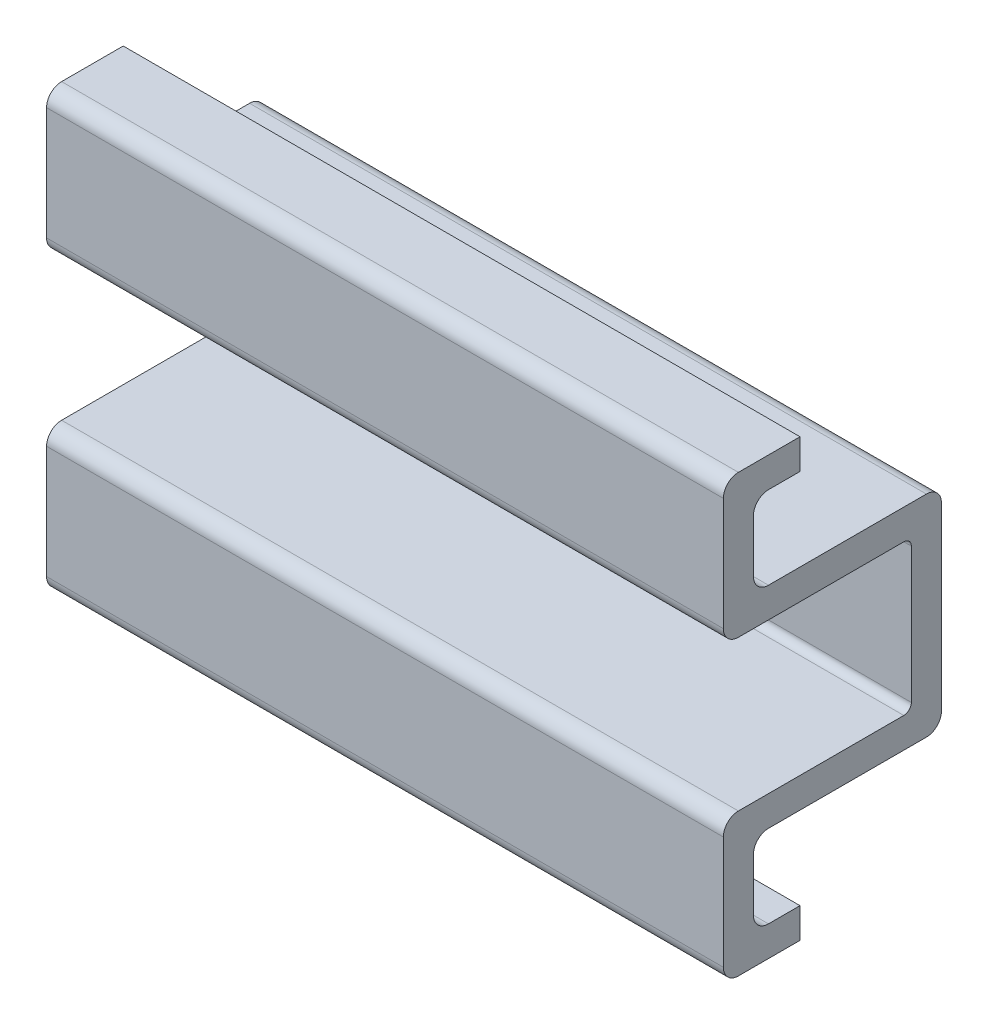
from build123d import *

# Parameters (mm, degrees)
BOSS_EXTRUDE1_DEPTH = 45
FILLET1_R           = 1
FILLET2_R           = 0.5


with BuildPart() as part:
    # Sketch3 → Boss-Extrude1 (new body)
    with BuildSketch(Plane(origin=(0, 0, 0), x_dir=(0, 0, -1), z_dir=(1, 0, 0))):
        Polygon((-3.729267548, 0), (-5.729267548, 0), (-5.729267548, -5), (-18.229267548, -5), (-18.229267548, -14.5), (-13.131696696, -14.5), (-13.131696696, -12.5), (-14.52244663, -12.5), (-16.229267548, -12.5), (-16.229267548, -7), (-3.729267548, -7), align=None)
        Polygon((-18.229267548, 5), (-5.729267548, 5), (-5.729267548, 0), (-3.729267548, 0), (-3.729267548, 7), (-16.229267548, 7), (-16.229267548, 12.5), (-14.52244663, 12.5), (-13.131696696, 12.5), (-13.131696696, 14.5), (-18.229267548, 14.5), align=None)
    extrude(amount=BOSS_EXTRUDE1_DEPTH)

    # Fillet1
    fillet1_edges = [part.edges().sort_by_distance(p)[0] for p in [
        (22.5, -14.5, 18.229267548),
        (22.5, -5, 18.229267548),
        (22.5, 5, 18.229267548),
        (22.5, 14.5, 18.229267548),
        (22.5, 12.5, 16.229267548),
        (22.5, 7, 16.229267548),
        (22.5, 7, 3.729267548),
        (22.5, -7, 3.729267548),
        (22.5, -7, 16.229267548),
        (22.5, -12.5, 16.229267548),
    ]]
    fillet(fillet1_edges, radius=FILLET1_R)

    # Fillet2
    fillet2_edges = [part.edges().sort_by_distance(p)[0] for p in [
        (22.5, -5, 5.729267548),
        (22.5, 5, 5.729267548),
    ]]
    fillet(fillet2_edges, radius=FILLET2_R)


solid = part.part
